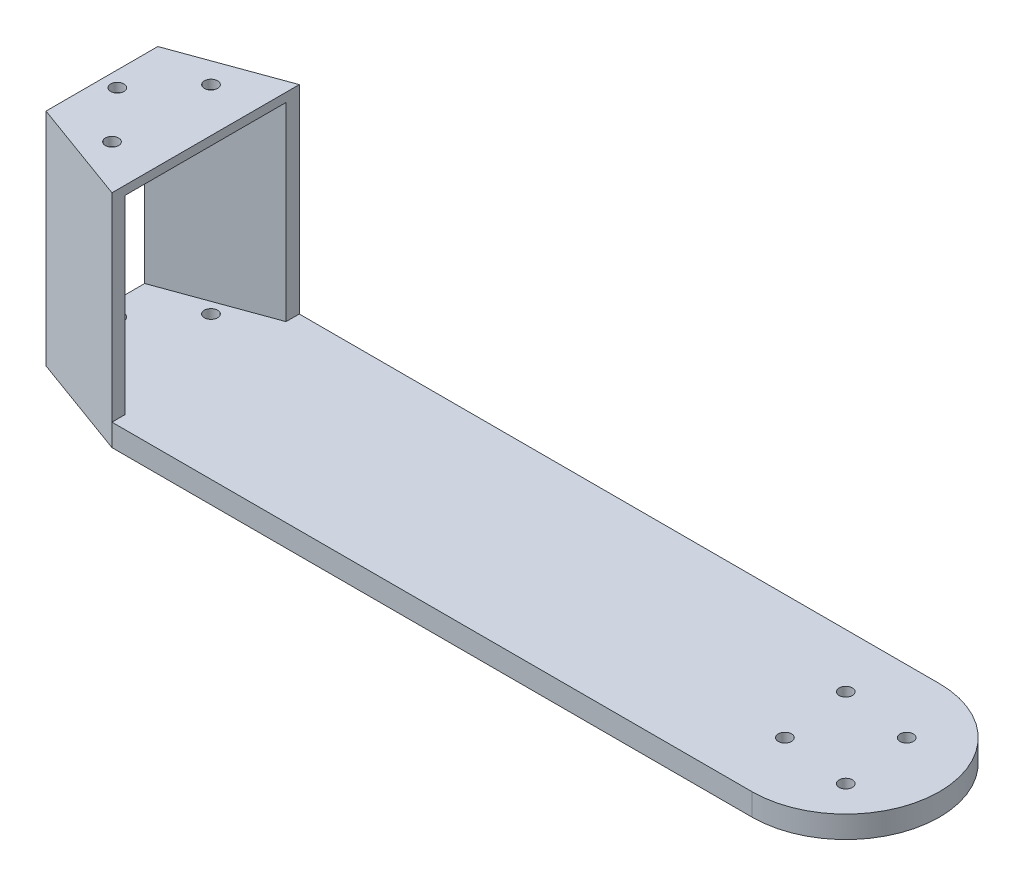
from build123d import *

# Parameters (mm, degrees)
EXTRUDE_1_DEPTH     = 5
SKETCH_3_R          = 1.5
CUT_EXTRUDE_1_DEPTH = 5
SKETCH_4_R          = 1.5
CUT_EXTRUDE_2_DEPTH = 50
EXTRUDE_2_DEPTH     = 45
CUT_EXTRUDE_START   = -45
SKETCH_8_R          = 1.5
CUT_EXTRUDE_3_DEPTH = 45


with BuildPart() as part:
    # 草图1 → 凸台-拉伸1 (new body)
    with BuildSketch(Plane(origin=(0, 0, 0), x_dir=(1, 0, 0), z_dir=(0, 1, 0))):
        with BuildLine():
            Line((72.807044649, 44.366167138), (49.314729129, 35.815663555))
            Line((49.314729129, 35.815663555), (49.314729129, 10.486670722))
            Line((49.314729129, 10.486670722), (72.807044649, 1.936167138))
            Line((72.807044649, 1.936167138), (217.807044649, 1.936167138))
            ThreePointArc((217.807044649, 1.936167138), (239.022044649, 23.151167138), (217.807044649, 44.366167138))
            Line((217.807044649, 44.366167138), (72.807044649, 44.366167138))
        make_face()
    extrude(amount=EXTRUDE_1_DEPTH)

    # 草图3 → 切除-拉伸1 (cut)
    with BuildSketch(Plane.XZ):
        with Locations(Location((226.822656109, -14.135555678, 0), (0, 0, 270))):
            Circle(SKETCH_3_R)
        with Locations(Location((224.701335766, -30.045458255, 0), (0, 0, 270))):
            Circle(SKETCH_3_R)
        with Locations(Location((208.791433189, -32.166778599, 0), (0, 0, 270))):
            Circle(SKETCH_3_R)
        with Locations(Location((210.912753532, -16.256876022, 0), (0, 0, 270))):
            Circle(SKETCH_3_R)
    extrude(amount=-CUT_EXTRUDE_1_DEPTH, mode=Mode.SUBTRACT)

    # 草图4 → 切除-拉伸2 (cut)
    with BuildSketch(Plane.XZ):
        with Locations(Location((62.807044649, -11.936167138, 0), (0, 0, 270))):
            Circle(SKETCH_4_R)
        with Locations(Location((52.807044649, -23.151167138, 0), (0, 0, 270))):
            Circle(SKETCH_4_R)
        with Locations(Location((62.807044649, -34.366167138, 0), (0, 0, 270))):
            Circle(SKETCH_4_R)
    extrude(amount=-CUT_EXTRUDE_2_DEPTH, mode=Mode.SUBTRACT)

    # 草图5 → 凸台-拉伸2 (add)
    with BuildSketch(Plane(origin=(0, 5, 0), x_dir=(1, 0, 0), z_dir=(0, 1, 0))):
        Polygon((72.807044649, 44.366167138), (72.807044649, 1.936167138), (49.314729129, 10.486670722), (49.314729129, 35.815663555), align=None)
    extrude(amount=EXTRUDE_2_DEPTH)

    # 草图6 → 切除-放样1 section 0
    with BuildSketch(Plane(origin=(72.807044649, 0, 0), x_dir=(0, 0, -1), z_dir=(1, 0, 0))):
        with BuildLine():
            Line((4.936167138, 5), (4.936167138, 48))
            Line((4.936167138, 48), (41.366167138, 48))
            Line((41.366167138, 48), (41.366167138, 5))
            Line((41.366167138, 5), (4.936167138, 5))
        make_face()
    # 草图7 → 切除-放样1 section 1
    with BuildSketch(Plane.ZY.offset(-49.314729129)):
        with BuildLine():
            Line((-32.839513374, 48), (-32.839513374, 5))
            Line((-32.839513374, 5), (-13.486670722, 5))
            Line((-13.486670722, 5), (-13.486670722, 48))
            Line((-13.486670722, 48), (-32.839513374, 48))
        make_face()
    loft(mode=Mode.SUBTRACT)

    # 草图8 → 切除-拉伸3 (cut)
    with BuildSketch(Plane(origin=(0, 50, 0), x_dir=(1, 0, 0), z_dir=(0, 1, 0)).offset(CUT_EXTRUDE_START)):
        with Locations(Location((62.807044649, 34.366167138, 0), (0, 0, 90))):
            Circle(SKETCH_8_R)
        with Locations(Location((52.807044649, 23.151167138, 0), (0, 0, 90))):
            Circle(SKETCH_8_R)
        with Locations(Location((62.807044649, 11.936167138, 0), (0, 0, 90))):
            Circle(SKETCH_8_R)
    extrude(amount=CUT_EXTRUDE_3_DEPTH, mode=Mode.SUBTRACT)


solid = part.part
